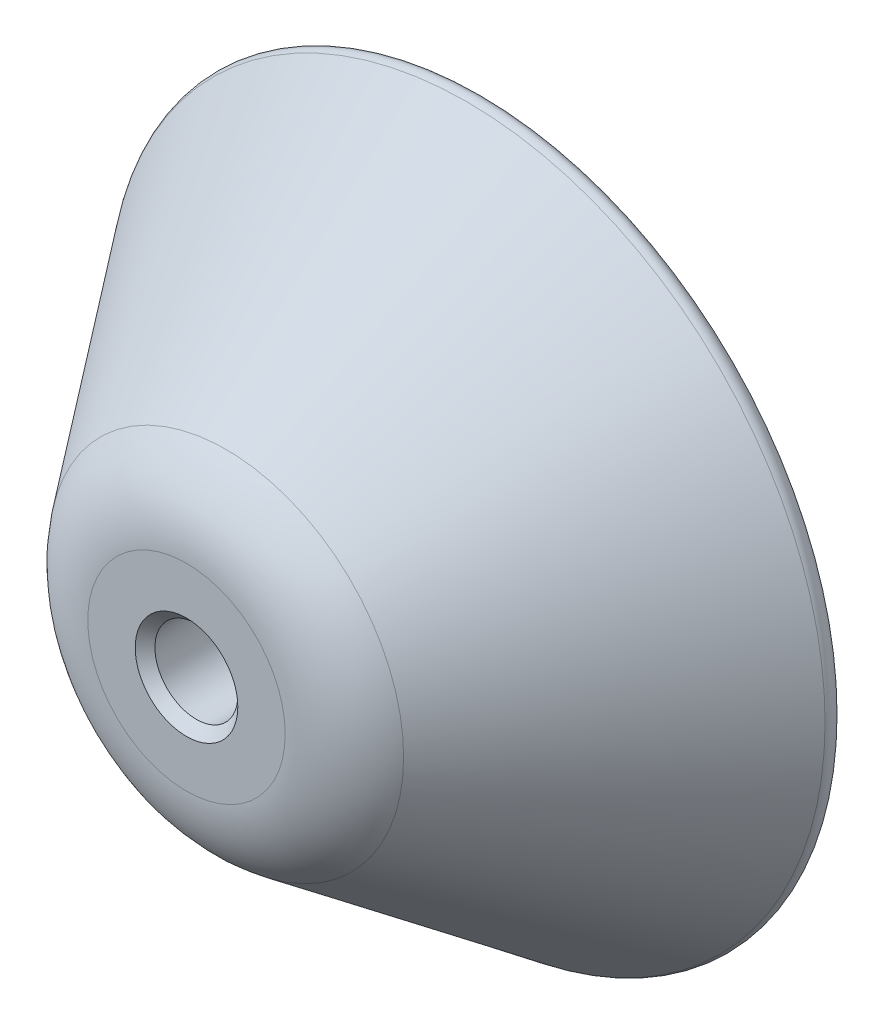
from build123d import *

# Parameters (mm, degrees)
FILLET1_R          = 1
FILLET2_R          = 10
SKETCH2_R          = 4.2
CUT_EXTRUDE1_DEPTH = 60.703433859
CUT_EXTRUDE2_START = -8
CUT_EXTRUDE2_DEPTH = 68.703433859
CHAMFER1_SIZE      = 1


with BuildPart() as part:
    # Sketch1 → Revolve1 (revolve)
    with BuildSketch(Plane(origin=(0, 0, 0), x_dir=(1, 0, 0), z_dir=(0, 1, 0))):
        Polygon((-37.5, 0), (0, 0), (0, -30), (-15, -30), align=None)
    revolve(axis=Axis((0, 0, 0), (0, 0, 1)))

    # Fillet1
    fillet1_edges = [part.edges().sort_by_distance(p)[0] for p in [
        (37.5, 0, 0),
    ]]
    fillet(fillet1_edges, radius=FILLET1_R)

    # Fillet2
    fillet2_edges = [part.edges().sort_by_distance(p)[0] for p in [
        (15, 0, 30),
    ]]
    fillet(fillet2_edges, radius=FILLET2_R)

    # Sketch2 → Cut-Extrude1 (cut, through all)
    with BuildSketch(Plane.XY.offset(30)):
        Circle(SKETCH2_R)
    extrude(amount=-CUT_EXTRUDE1_DEPTH, mode=Mode.SUBTRACT)

    # Sketch3 → Cut-Extrude2 (cut, through all)
    with BuildSketch(Plane(origin=(0, 0, 0), x_dir=(-1, 0, 0), z_dir=(0, 0, -1)).offset(CUT_EXTRUDE2_START)):
        Polygon((-8.29998747, 0), (-4.149993735, -7.188), (4.149993735, -7.188), (8.29998747, 0), (4.149993735, 7.188), (-4.149993735, 7.188), align=None)
    extrude(amount=CUT_EXTRUDE2_DEPTH, mode=Mode.SUBTRACT)

    # Chamfer1
    chamfer1_edges = [part.edges().sort_by_distance(p)[0] for p in [
        (-4.2, 0, 30),
        (6.224990602, 3.594, 0),
        (6.224990602, -3.594, 0),
        (0, -7.188, 0),
        (-6.224990602, -3.594, 0),
        (-6.224990602, 3.594, 0),
        (0, 7.188, 0),
        (-4.2, 0, 8),
    ]]
    chamfer(chamfer1_edges, length=CHAMFER1_SIZE)


solid = part.part
